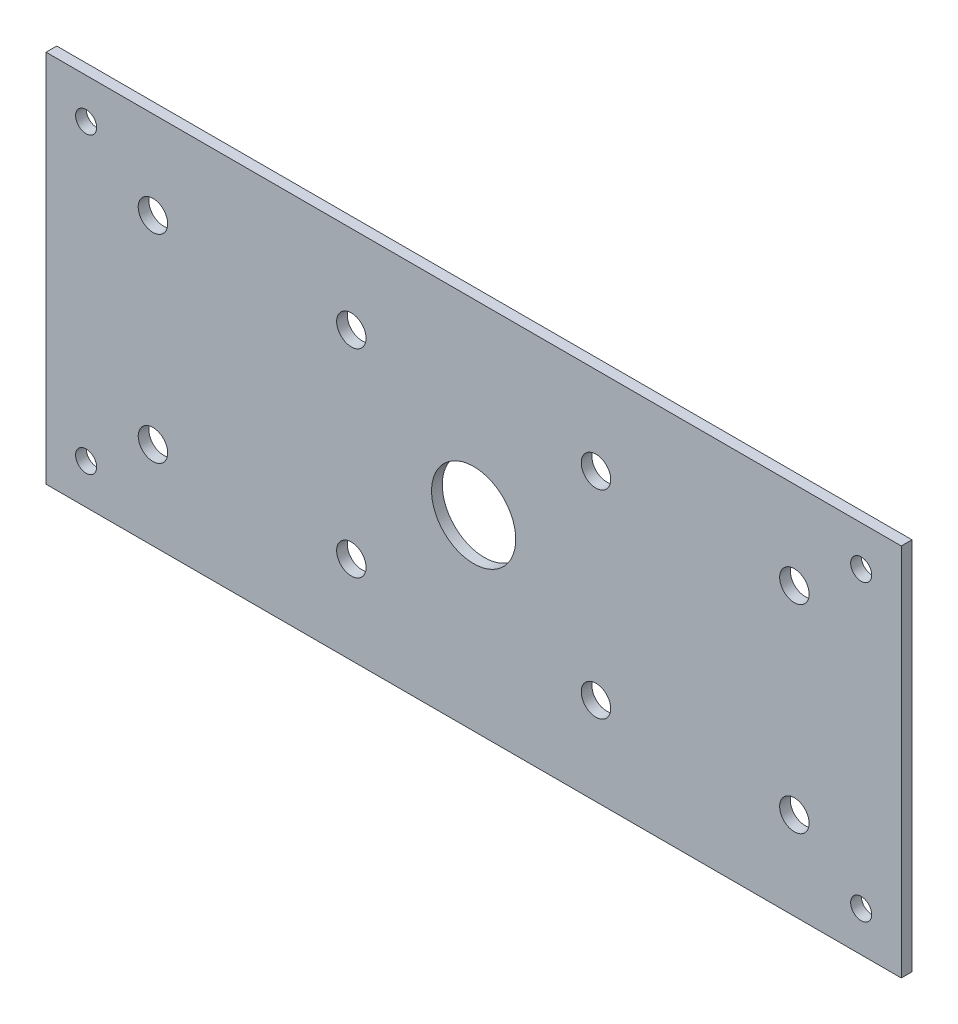
from build123d import *

# Parameters (mm, degrees)
SKETCH2_W           = 203.2
SKETCH2_H           = 88.9
SKETCH2_R           = 3.5
SKETCH2_R_2         = 10
BOSS_EXTRUDE1_DEPTH = 1.27
SKETCH3_R           = 2.5
CUT_EXTRUDE1_DEPTH  = 111.92706658


with BuildPart() as part:
    # Sketch2 → Boss-Extrude1 (new, symmetric)
    with BuildSketch(Plane.XY):
        Rectangle(SKETCH2_W, SKETCH2_H)
        with Locations((-76.2, 23.57)):
            Circle(SKETCH2_R, mode=Mode.SUBTRACT)
        with Locations((-29.06, 23.57)):
            Circle(SKETCH2_R, mode=Mode.SUBTRACT)
        with Locations((-29.06, -23.57)):
            Circle(SKETCH2_R, mode=Mode.SUBTRACT)
        with Locations((-76.2, -23.57)):
            Circle(SKETCH2_R, mode=Mode.SUBTRACT)
        with Locations((29.06, -23.57)):
            Circle(SKETCH2_R, mode=Mode.SUBTRACT)
        with Locations((76.2, -23.57)):
            Circle(SKETCH2_R, mode=Mode.SUBTRACT)
        with Locations((76.2, 23.57)):
            Circle(SKETCH2_R, mode=Mode.SUBTRACT)
        with Locations((29.06, 23.57)):
            Circle(SKETCH2_R, mode=Mode.SUBTRACT)
        Circle(SKETCH2_R_2, mode=Mode.SUBTRACT)
    extrude(amount=BOSS_EXTRUDE1_DEPTH, both=True)

    # Sketch3 → Cut-Extrude1 (cut, through all)
    with BuildSketch(Plane.XY.offset(1.27)):
        with Locations((-92.075, 34.925)):
            Circle(SKETCH3_R)
        with Locations((-92.075, -34.925)):
            Circle(SKETCH3_R)
        with Locations((92.075, -34.925)):
            Circle(SKETCH3_R)
        with Locations((92.075, 34.925)):
            Circle(SKETCH3_R)
    extrude(amount=-CUT_EXTRUDE1_DEPTH, mode=Mode.SUBTRACT)


solid = part.part
